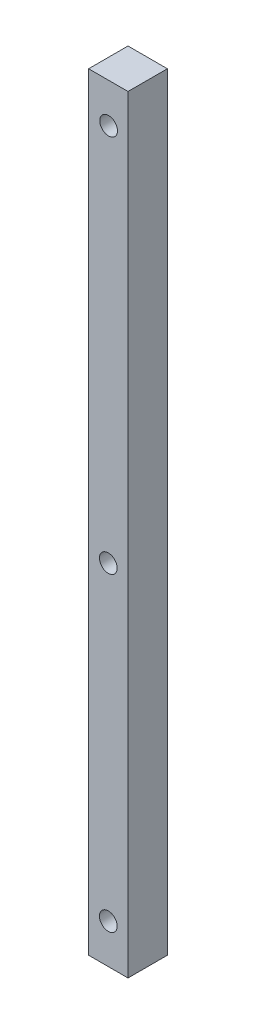
from build123d import *

# Parameters (mm, degrees)
SKETCH1_W           = 5.08
SKETCH1_H           = 99.042864388
SKETCH1_R           = 1.143
BOSS_EXTRUDE1_DEPTH = 5.08


with BuildPart() as part:
    # Sketch1 → Boss-Extrude1 (new body)
    with BuildSketch(Plane.XY):
        with Locations((-0.039379845, -129.577356123)):
            Rectangle(SKETCH1_W, SKETCH1_H)
        with Locations((-0.039379845, -134.018788317)):
            Circle(SKETCH1_R, mode=Mode.SUBTRACT)
        with Locations((0, -85.135923929)):
            Circle(SKETCH1_R, mode=Mode.SUBTRACT)
        with Locations((-0.039379845, -174.018788317)):
            Circle(SKETCH1_R, mode=Mode.SUBTRACT)
    extrude(amount=BOSS_EXTRUDE1_DEPTH)


solid = part.part
